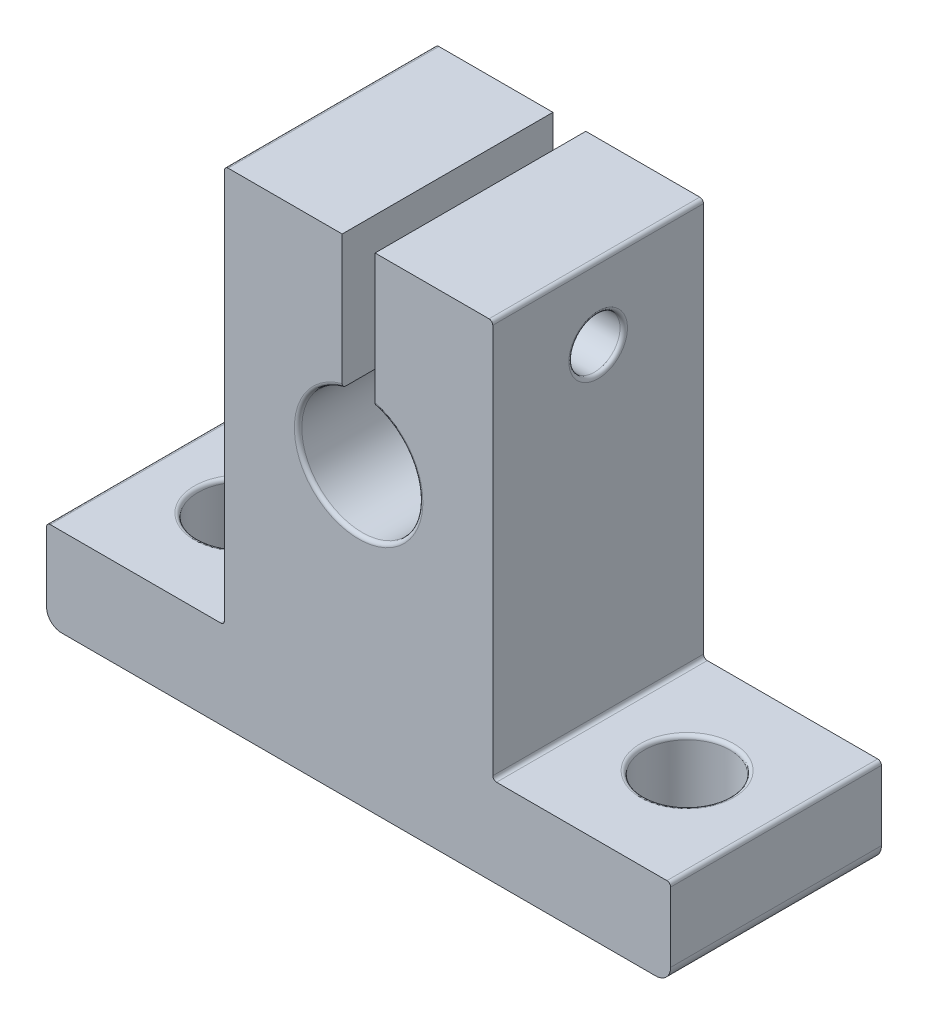
from build123d import *

# Parameters (mm, degrees)
BOSS_EXTRUDE1_DEPTH        = 7.05
MOUNTING_HOLES_REACH       = 36.54
SKETCH2_R                  = 2.875
SKETCH3_R                  = 1.71
BOLT_HOLE_DEPTH            = 45.687526224
SKETCH4_R                  = 3.675
BOLT_HEAD_DEPTH            = 3.95
HOLES_R                    = 0.25
SKETCH5_R                  = 4.075
BOLT_HEAD_INT_FILLET_DEPTH = 0.5
BOLT_HEAD_INT_FILLET_DRAFT = -45
BOTTOM_MOUNTING_R          = 0.5
BOTTOM_CORNERS_R           = 1
CORNERS_R                  = 0.25


with BuildPart() as part:
    # Sketch1 → Boss-Extrude1 (new, symmetric)
    with BuildSketch(Plane.XY):
        with BuildLine():
            Line((-20.875, 0), (20.875, 0))
            Line((20.875, 0), (20.875, 5.9))
            Line((20.875, 5.9), (8.975, 5.9))
            Line((8.975, 5.9), (8.975, 32.5))
            Line((8.975, 32.5), (1.1, 32.5))
            Line((1.1, 32.5), (1.1, 23.572755765))
            ThreePointArc((1.1, 23.572755765), (0, 15.625), (-1.1, 23.572755765))
            Line((-1.1, 23.572755765), (-1.1, 32.5))
            Line((-1.1, 32.5), (-8.975, 32.5))
            Line((-8.975, 32.5), (-8.975, 5.9))
            Line((-8.975, 5.9), (-20.875, 5.9))
            Line((-20.875, 5.9), (-20.875, 0))
        make_face()
    extrude(amount=BOSS_EXTRUDE1_DEPTH, both=True)

    # Sketch2 → Mounting Holes (cut, up to next)
    with BuildSketch(Plane(origin=(0, 5.9, 0), x_dir=(1, 0, 0), z_dir=(0, 1, 0)), mode=Mode.PRIVATE) as mounting_holes_sk1:
        with Locations(Location((14.925, 0, 0), (0, 0, 180))):
            Circle(SKETCH2_R)
    mounting_holes_tool1 = extrude(mounting_holes_sk1.sketch, amount=-MOUNTING_HOLES_REACH, mode=Mode.PRIVATE) & part.part
    # Sketch2 → Mounting Holes (cut, up to next)
    with BuildSketch(Plane(origin=(0, 5.9, 0), x_dir=(1, 0, 0), z_dir=(0, 1, 0)), mode=Mode.PRIVATE) as mounting_holes_sk2:
        with Locations(Location((-14.925, 0, 0), (0, 0, 180))):
            Circle(SKETCH2_R)
    mounting_holes_tool2 = extrude(mounting_holes_sk2.sketch, amount=-MOUNTING_HOLES_REACH, mode=Mode.PRIVATE) & part.part
    add(mounting_holes_tool1.solids().sort_by_distance((14.925, 5.9, 0))[0], mode=Mode.SUBTRACT)
    add(mounting_holes_tool2.solids().sort_by_distance((-14.925, 5.9, 0))[0], mode=Mode.SUBTRACT)

    # Sketch3 → Bolt Hole (cut, through all)
    with BuildSketch(Plane(origin=(8.975, 0, 0), x_dir=(0, 0, -1), z_dir=(1, 0, 0))):
        with Locations((0, 27.59)):
            Circle(SKETCH3_R)
    extrude(amount=-BOLT_HOLE_DEPTH, mode=Mode.SUBTRACT)

    # Sketch4 → Bolt Head (cut)
    with BuildSketch(Plane.ZY.offset(8.975)):
        with Locations((0, 27.59)):
            Circle(SKETCH4_R)
    extrude(amount=-BOLT_HEAD_DEPTH, mode=Mode.SUBTRACT)

    # Holes
    holes_edges = [part.edges().sort_by_distance(p)[0] for p in [
        (0, 15.625, -7.05),
        (0, 15.625, 7.05),
        (17.8, 5.9, 0),
        (-12.05, 5.9, 0),
        (8.975, 27.59, 1.71),
    ]]
    fillet(holes_edges, radius=HOLES_R)


with BuildPart() as bolt_head_int_fillet_tool:
    # Sketch5 → Bolt Head Int Fillet (with draft: the straight prism first)
    with BuildSketch(Plane.ZY.offset(8.975)):
        with Locations((0, 27.59)):
            Circle(SKETCH5_R)
    extrude(amount=-BOLT_HEAD_INT_FILLET_DEPTH)
    # Bolt Head Int Fillet: the draft: its side faces are tilted about the plane it starts from
    bolt_head_int_fillet_sides = [bolt_head_int_fillet_tool.faces().sort_by_distance(p)[0] for p in [
        (-8.725, 27.59, -4.075),
    ]]
    draft(bolt_head_int_fillet_sides, Plane.ZY.offset(8.975), BOLT_HEAD_INT_FILLET_DRAFT)


with BuildPart() as part_1:
    add(part.part)

    # Bolt Head Int Fillet: cut by bolt_head_int_fillet_tool
    add(bolt_head_int_fillet_tool.part, mode=Mode.SUBTRACT)

    # Bottom Mounting
    bottom_mounting_edges = [part_1.edges().sort_by_distance(p)[0] for p in [
        (17.8, 0, 0),
        (-12.05, 0, 0),
    ]]
    fillet(bottom_mounting_edges, radius=BOTTOM_MOUNTING_R)

    # Bottom Corners
    bottom_corners_edges = [part_1.edges().sort_by_distance(p)[0] for p in [
        (20.875, 0, 0),
        (-20.875, 0, 0),
    ]]
    fillet(bottom_corners_edges, radius=BOTTOM_CORNERS_R)

    # Corners
    corners_edges = [part_1.edges().sort_by_distance(p)[0] for p in [
        (-20.875, 5.9, 0),
        (-8.975, 5.9, 0),
        (-8.975, 32.5, 0),
        (8.975, 32.5, 0),
        (8.975, 5.9, 0),
        (20.875, 5.9, 0),
    ]]
    fillet(corners_edges, radius=CORNERS_R)


solid = part_1.part
